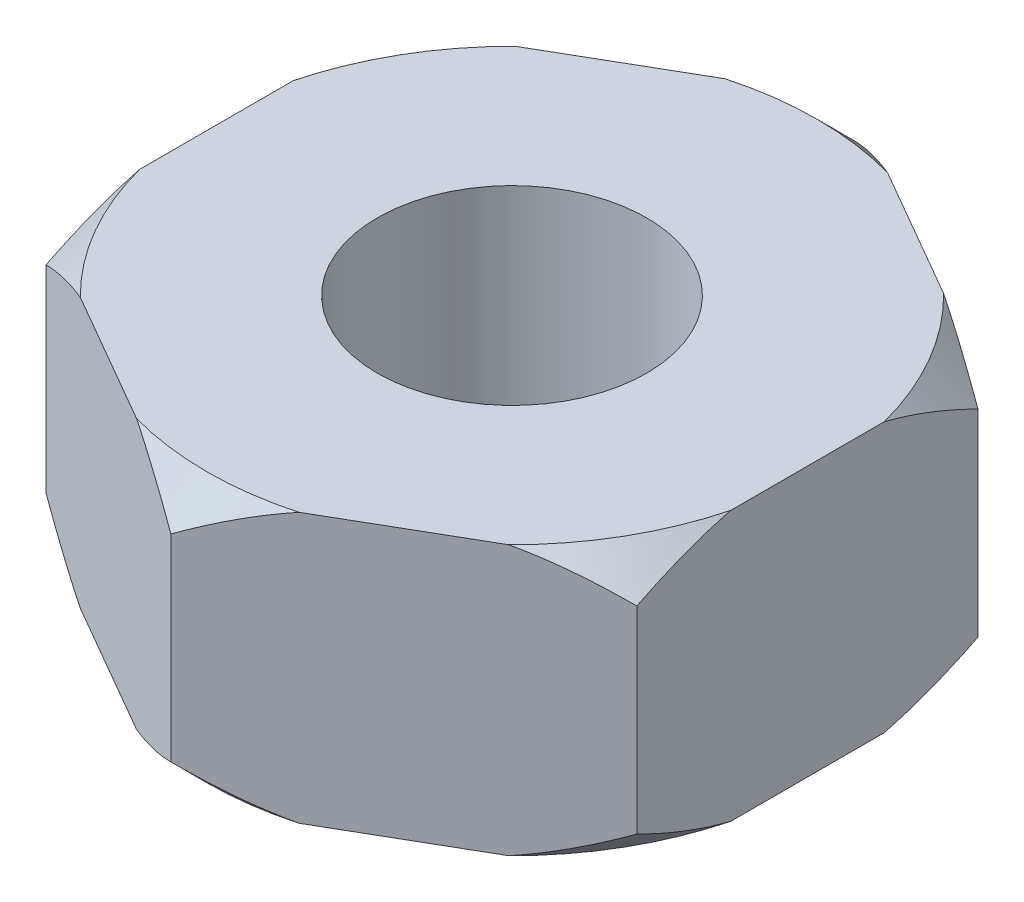
from build123d import *

# Parameters (mm, degrees)
BOSS_EXTRUDE1_DEPTH = 15
SKETCH4_R           = 7.5
CUT_EXTRUDE1_DEPTH  = 30.270292107


with BuildPart() as part:
    # Sketch3 → Boss-Extrude1 (new body)
    with BuildSketch(Plane(origin=(0, 0, 0), x_dir=(1, 0, 0), z_dir=(0, 1, 0))):
        Polygon((0, -19), (16.454482672, -9.5), (16.454482672, 9.5), (0, 19), (-16.454482672, 9.5), (-16.454482672, -9.5), align=None)
    extrude(amount=BOSS_EXTRUDE1_DEPTH)

    # Sketch4 → Cut-Extrude1 (cut, through all)
    with BuildSketch(Plane(origin=(0, 15, 0), x_dir=(1, 0, 0), z_dir=(0, 1, 0))):
        with Locations(Location((0, 0, 0), (0, 0, 270))):
            Circle(SKETCH4_R)
    extrude(amount=-CUT_EXTRUDE1_DEPTH, mode=Mode.SUBTRACT)

    # Sketch6 → Cut-Revolve1 (revolve, cut)
    with BuildSketch(Plane(origin=(0, 0, 0), x_dir=(0, 0, -1), z_dir=(1, 0, 0))):
        Polygon((16.222397812, 15.777602188), (21.222397812, 10.777602188), (21.222397812, 15.777602188), align=None)
    revolve(axis=Axis((0, 0, 0), (0, 1, 0)), mode=Mode.SUBTRACT)

    # Sketch8 → Cut-Revolve2 (revolve, cut)
    with BuildSketch(Plane(origin=(0, 0, 0), x_dir=(0, 0, -1), z_dir=(1, 0, 0))):
        Polygon((16.303352357, -0.696647643), (21.303352357, 4.303352357), (21.303352357, -0.696647643), align=None)
    revolve(axis=Axis((0, 0, 0), (0, 1, 0)), mode=Mode.SUBTRACT)


solid = part.part
